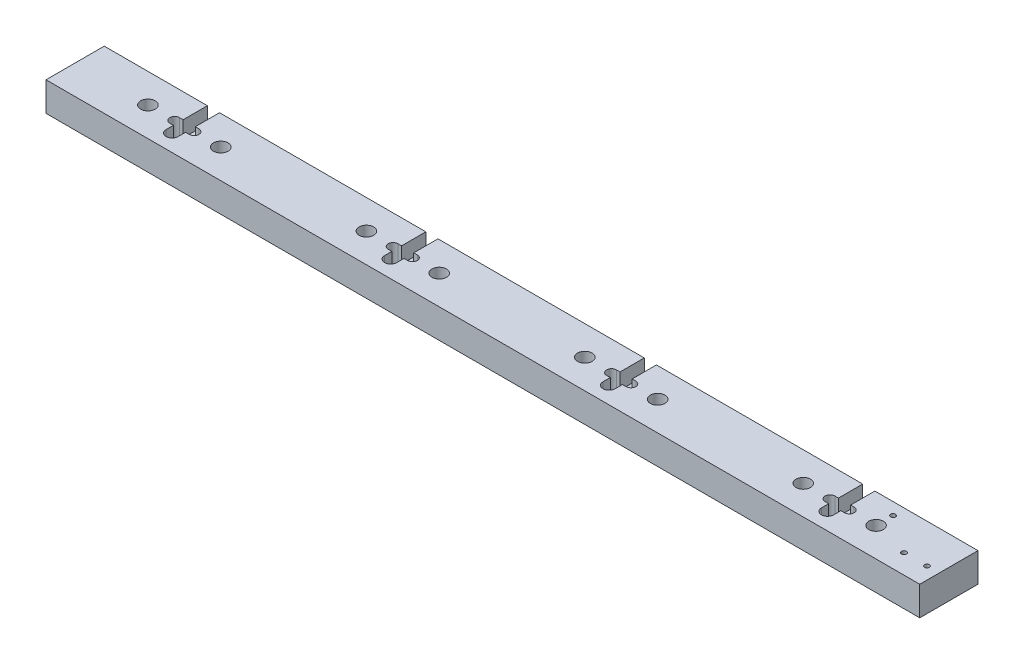
from build123d import *

# Parameters (mm, degrees)
SKETCH1_W                = 360
SKETCH1_H                = 24
BOSS_EXTRUDE1_DEPTH      = 12
CUT_EXTRUDE1_REACH       = 182.798
SKETCH2_R                = 3
CUT_EXTRUDE2_DEPTH       = 8
CUT_EXTRUDE3_DEPTH       = 6.5
LPATTERN1_COUNT          = 4
LPATTERN1_PITCH          = 90
F_2_0_2_DIAMETER_HOLE1_D = 2


with BuildPart() as part:
    # Sketch1 → Boss-Extrude1 (new body)
    with BuildSketch(Plane(origin=(0, 0, 0), x_dir=(1, 0, 0), z_dir=(0, 1, 0))):
        Rectangle(SKETCH1_W, SKETCH1_H)
    extrude(amount=BOSS_EXTRUDE1_DEPTH)

    # Sketch2 → Cut-Extrude1 (cut, up to next)
    with BuildSketch(Plane(origin=(0, 12, 0), x_dir=(1, 0, 0), z_dir=(0, 1, 0)), mode=Mode.PRIVATE) as cut_extrude1_sk1:
        with Locations(Location((-150, 0, 0), (0, 0, 270))):
            Circle(SKETCH2_R)
    cut_extrude1_tool1 = extrude(cut_extrude1_sk1.sketch, amount=-CUT_EXTRUDE1_REACH, mode=Mode.PRIVATE) & part.part
    # Sketch2 → Cut-Extrude1 (cut, up to next)
    with BuildSketch(Plane(origin=(0, 12, 0), x_dir=(1, 0, 0), z_dir=(0, 1, 0)), mode=Mode.PRIVATE) as cut_extrude1_sk2:
        with Locations(Location((-120, 0, 0), (0, 0, 270))):
            Circle(SKETCH2_R)
    cut_extrude1_tool2 = extrude(cut_extrude1_sk2.sketch, amount=-CUT_EXTRUDE1_REACH, mode=Mode.PRIVATE) & part.part
    cut_extrude1_1 = cut_extrude1_tool1.solids().sort_by_distance((-150, 12, 0))[0]
    add(cut_extrude1_1, mode=Mode.SUBTRACT)
    cut_extrude1_2 = cut_extrude1_tool2.solids().sort_by_distance((-120, 12, 0))[0]
    add(cut_extrude1_2, mode=Mode.SUBTRACT)
    cut_extrude1 = cut_extrude1_1 + cut_extrude1_2  # Cut-Extrude1 as one shape, for the pattern or mirror that repeats it

    # Sketch11 → Cut-Extrude2 (cut)
    with BuildSketch(Plane(origin=(-63.484819349, 12, 93.481372316), x_dir=(-1, 0, 0), z_dir=(0, 1, 0))):
        with BuildLine():
            Line((67.515180651, -91.481372316), (75.515180651, -91.481372316))
            ThreePointArc((75.515180651, -91.481372316), (77.515180651, -93.481372316), (75.515180651, -95.481372316))
            Line((75.515180651, -95.481372316), (67.515180651, -95.481372316))
            ThreePointArc((67.515180651, -95.481372316), (65.515180651, -93.481372316), (67.515180651, -91.481372316))
        make_face()
    cut_extrude2 = extrude(amount=-CUT_EXTRUDE2_DEPTH, mode=Mode.SUBTRACT)

    # Sketch13 → Cut-Extrude3 (cut)
    with BuildSketch(Plane(origin=(-63.484819349, 12, 93.481372316), x_dir=(-1, 0, 0), z_dir=(0, 1, 0))):
        with BuildLine():
            Line((74.015180651, -88.481372316), (74.015180651, -142.11123171))
            ThreePointArc((74.015180651, -142.11123171), (71.515180651, -144.61123171), (69.015180651, -142.11123171))
            Line((69.015180651, -142.11123171), (69.015180651, -88.481372316))
            ThreePointArc((69.015180651, -88.481372316), (71.515180651, -85.981372316), (74.015180651, -88.481372316))
        make_face()
    cut_extrude3 = extrude(amount=-CUT_EXTRUDE3_DEPTH, mode=Mode.SUBTRACT)

    # LPattern1: Cut-Extrude1, Cut-Extrude2, Cut-Extrude3 ×4
    with Locations(*[(i * LPATTERN1_PITCH, 0, 0) for i in range(1, LPATTERN1_COUNT)]):
        add(cut_extrude1, mode=Mode.SUBTRACT)
        add(cut_extrude2, mode=Mode.SUBTRACT)
        add(cut_extrude3, mode=Mode.SUBTRACT)

    # Ø2.0 (2) Diameter Hole1 (through all)
    with Locations(Plane.XZ):
        with Locations((165.5, 4), (175, 4), (150, -7)):
            Hole(F_2_0_2_DIAMETER_HOLE1_D / 2)


solid = part.part
